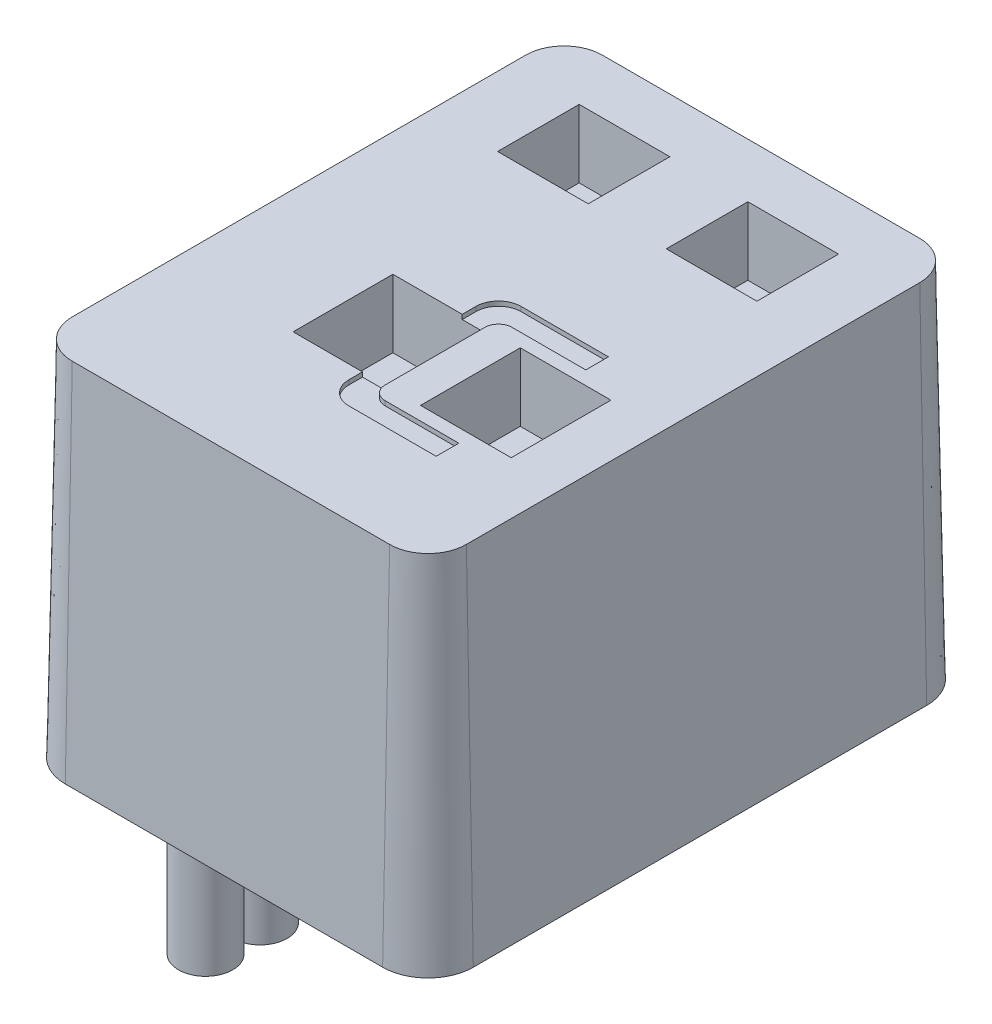
from build123d import *

# Parameters (mm, degrees)
EXTRUSI_N1_DEPTH          = 8
EXTRUSI_N1_TAPER          = 1.0995
CROQUIS2_W                = 2
CROQUIS2_H                = 2.2
CROQUIS2_H_2              = 1.8
EXTRUSI_N2_DEPTH          = 1.5
EXTRUSI_N3_DEPTH          = 0.1
SALIENTE_EXTRUIR2_DEPTH   = 4
CROQUIS6_R                = 0.6
SALIENTE_EXTRUIR2_2_DEPTH = 4
SALIENTE_EXTRUIR2_3_DEPTH = 4


with BuildPart() as part:
    # Croquis1 → Extrusión1 (new body)
    with BuildSketch(Plane(origin=(0, 0, 0), x_dir=(-1, 0, 0), z_dir=(0, 1, 0))):
        with BuildLine():
            Line((4.5, -5), (4.5, 5))
            ThreePointArc((4.5, 5), (4.207106781, 5.707106781), (3.5, 6))
            Line((3.5, 6), (-3.5, 6))
            ThreePointArc((-3.5, 6), (-4.207106781, 5.707106781), (-4.5, 5))
            Line((-4.5, 5), (-4.5, -5))
            ThreePointArc((-4.5, -5), (-4.207106781, -5.707106781), (-3.5, -6))
            Line((-3.5, -6), (3.5, -6))
            ThreePointArc((3.5, -6), (4.207106781, -5.707106781), (4.5, -5))
        make_face()
    extrude(amount=EXTRUSI_N1_DEPTH, taper=EXTRUSI_N1_TAPER)

    # Croquis2 → Extrusión2 (cut)
    with BuildSketch(Plane(origin=(0, 8, 0), x_dir=(-1, 0, 0), z_dir=(0, 1, 0))):
        with Locations((0.625, 1.75)):
            Rectangle(CROQUIS2_W, CROQUIS2_H)
        with Locations((-2.185, 1.75)):
            Rectangle(CROQUIS2_W, CROQUIS2_H)
        with Locations((-1.905, -3.75)):
            Rectangle(CROQUIS2_W, CROQUIS2_H_2)
        with Locations((1.815, -3.75)):
            Rectangle(CROQUIS2_W, CROQUIS2_H_2)
    extrude(amount=-EXTRUSI_N2_DEPTH, mode=Mode.SUBTRACT)

    # Croquis3 → Extrusión3 (cut)
    with BuildSketch(Plane(origin=(0, 8, 0), x_dir=(-1, 0, 0), z_dir=(0, 1, 0))):
        with BuildLine():
            Line((0.095, 0.35), (0.095, 3.15))
            ThreePointArc((0.095, 3.15), (-0.051446609, 3.503553391), (-0.405, 3.65))
            Line((-0.405, 3.65), (-2.33, 3.65))
            Line((-2.33, 3.65), (-2.33, 3.15))
            Line((-2.33, 3.15), (-0.705, 3.15))
            ThreePointArc((-0.705, 3.15), (-0.492867966, 3.062132034), (-0.405, 2.85))
            Line((-0.405, 2.85), (-0.405, 0.65))
            ThreePointArc((-0.405, 0.65), (-0.492867966, 0.437867966), (-0.705, 0.35))
            Line((-0.705, 0.35), (-2.33, 0.35))
            Line((-2.33, 0.35), (-2.33, -0.15))
            Line((-2.33, -0.15), (-0.405, -0.15))
            ThreePointArc((-0.405, -0.15), (-0.051446609, -0.003553391), (0.095, 0.35))
        make_face()
    extrude(amount=-EXTRUSI_N3_DEPTH, mode=Mode.SUBTRACT)


with BuildPart() as body_2:
    # Croquis6 → Saliente-Extruir2 (new body)
    with BuildSketch(Plane.XZ):
        with BuildLine():
            ThreePointArc((-3.302200992, 1.303336386), (-2.702200992, 0.703336386), (-2.102200992, 1.303336386))
            ThreePointArc((-2.102200992, 1.303336386), (-2.702200992, 1.903336386), (-3.302200992, 1.303336386))
        make_face()
    extrude(amount=SALIENTE_EXTRUIR2_DEPTH)


with BuildPart() as body_3:
    # Croquis6 → Saliente-Extruir2 2 (new body)
    with BuildSketch(Plane.XZ):
        with Locations(Location((-2.702200992, 2.503336386, 0), (0, 0, 270))):
            Circle(CROQUIS6_R)
    extrude(amount=SALIENTE_EXTRUIR2_2_DEPTH)


with BuildPart() as body_4:
    # Croquis6 → Saliente-Extruir2 3 (new body)
    with BuildSketch(Plane.XZ):
        with BuildLine():
            ThreePointArc((-2.102200992, 3.703336386), (-2.702200992, 4.303336386), (-3.302200992, 3.703336386))
            ThreePointArc((-3.302200992, 3.703336386), (-2.702200992, 3.103336386), (-2.102200992, 3.703336386))
        make_face()
    extrude(amount=SALIENTE_EXTRUIR2_3_DEPTH)


solid = Compound([part.part, body_2.part, body_3.part, body_4.part])
